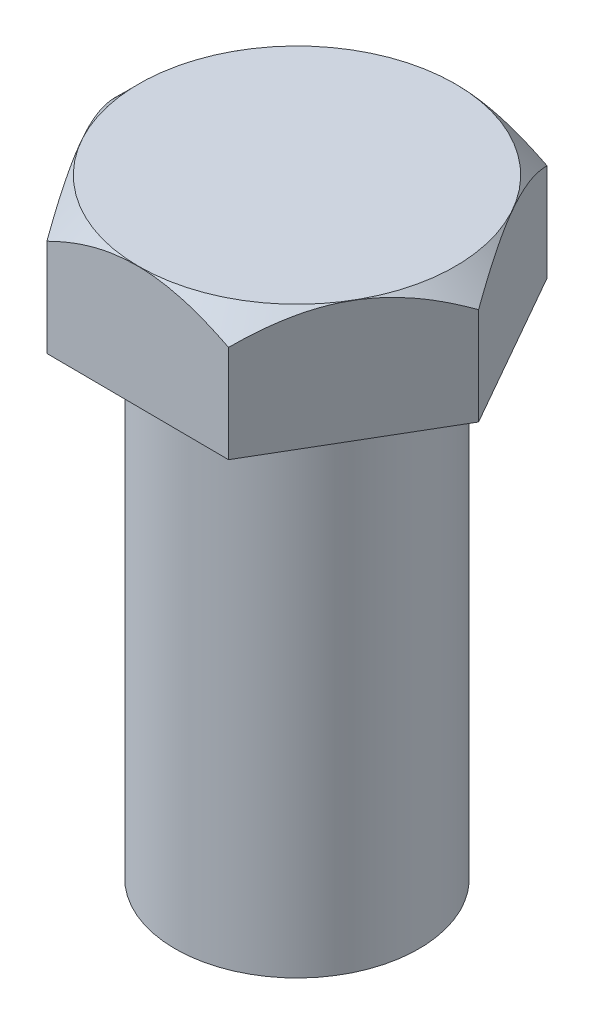
from build123d import *

# Parameters (mm, degrees)
SKETCH1_R           = 3
BOSS_EXTRUDE1_DEPTH = 12
SKETCH2_R           = 4.5
BOSS_EXTRUDE2_DEPTH = 3
CUT_EXTRUDE3_START  = -3
CUT_EXTRUDE3_DEPTH  = 3
SKETCH4_OUTSIDE_W   = 49.116
SKETCH4_OUTSIDE_H   = 47.938
SKETCH4_OUTSIDE_R   = 3.895
CUT_EXTRUDE4_DEPTH  = 17.141517221
CUT_EXTRUDE4_DRAFT  = -45


with BuildPart() as part:
    # Sketch1 → Boss-Extrude1 (new body)
    with BuildSketch(Plane(origin=(0, 0, 0), x_dir=(1, 0, 0), z_dir=(0, 1, 0))):
        Circle(SKETCH1_R)
    extrude(amount=BOSS_EXTRUDE1_DEPTH)

    # Sketch2 → Boss-Extrude2 (add)
    with BuildSketch(Plane(origin=(0, 12, 0), x_dir=(1, 0, 0), z_dir=(0, 1, 0))):
        Circle(SKETCH2_R)
    extrude(amount=BOSS_EXTRUDE2_DEPTH)

    # Sketch3 → Cut-Extrude3 (cut)
    with BuildSketch(Plane(origin=(0, 15, 0), x_dir=(1, 0, 0), z_dir=(0, 1, 0)).offset(CUT_EXTRUDE3_START)):
        with BuildLine():
            ThreePointArc((-2.274915326, -3.882622858), (-0.028823035, -4.499907692), (2.224992365, -3.911445893))
            Line((2.224992365, -3.911445893), (-2.274915326, -3.882622858))
        make_face()
        with BuildLine():
            Line((4.499907692, -0.028823035), (2.224992365, -3.911445893))
            ThreePointArc((2.224992365, -3.911445893), (3.882622858, -2.274915326), (4.499907692, -0.028823035))
        make_face()
        with BuildLine():
            Line((2.274915326, 3.882622858), (4.499907692, -0.028823035))
            ThreePointArc((4.499907692, -0.028823035), (3.911445893, 2.224992365), (2.274915326, 3.882622858))
        make_face()
        with BuildLine():
            ThreePointArc((-4.499907692, 0.028823035), (-3.911445893, -2.224992365), (-2.274915326, -3.882622858))
            Line((-2.274915326, -3.882622858), (-4.499907692, 0.028823035))
        make_face()
        with BuildLine():
            Line((-2.224992365, 3.911445893), (2.274915326, 3.882622858))
            ThreePointArc((2.274915326, 3.882622858), (0.028823035, 4.499907692), (-2.224992365, 3.911445893))
        make_face()
        with BuildLine():
            ThreePointArc((-2.224992365, 3.911445893), (-3.882622858, 2.274915326), (-4.499907692, 0.028823035))
            Line((-4.499907692, 0.028823035), (-2.224992365, 3.911445893))
        make_face()
    extrude(amount=CUT_EXTRUDE3_DEPTH, mode=Mode.SUBTRACT)


with BuildPart() as cut_extrude4_tool:
    # Sketch4 outside → Cut-Extrude4 (with draft: the straight prism first)
    with BuildSketch(Plane(origin=(0, 15, 0), x_dir=(1, 0, 0), z_dir=(0, 1, 0))):
        Rectangle(SKETCH4_OUTSIDE_W, SKETCH4_OUTSIDE_H)
        Circle(SKETCH4_OUTSIDE_R, mode=Mode.SUBTRACT)
    extrude(amount=-CUT_EXTRUDE4_DEPTH)
    # Cut-Extrude4: the draft: its side faces are tilted about the plane it starts from
    cut_extrude4_sides = [cut_extrude4_tool.faces().sort_by_distance(p)[0] for p in [
        (0, 6.429241389, 23.969),
        (24.558, 6.429241389, 0),
        (0, 6.429241389, -23.969),
        (-24.558, 6.429241389, 0),
        (-3.895, 6.429241389, 0),
    ]]
    draft(cut_extrude4_sides, Plane(origin=(0, 15, 0), x_dir=(1, 0, 0), z_dir=(0, 1, 0)), CUT_EXTRUDE4_DRAFT)


with BuildPart() as part_1:
    add(part.part)

    # Cut-Extrude4: cut by cut_extrude4_tool
    add(cut_extrude4_tool.part, mode=Mode.SUBTRACT)


solid = part_1.part
